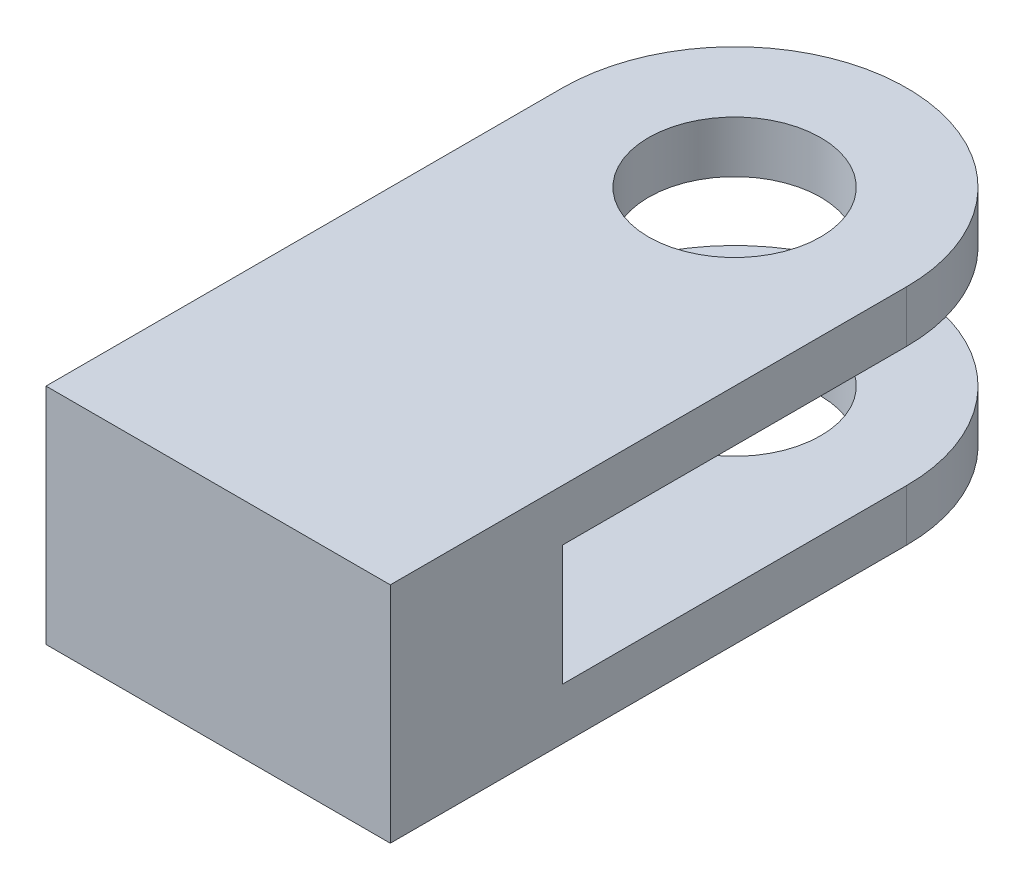
from build123d import *

# Parameters (mm, degrees)
BOSS_EXTRU_1_DEPTH           = 6.5
ENL_V_MAT_EXTRU_1_DEPTH      = 20
ENL_V_MAT_EXTRU_1_DEPTH_BACK = 33.283896915
ESQUISSE4_W                  = 20
ESQUISSE4_H                  = 7
ESQUISSE5_R                  = 5
ENL_V_MAT_EXTRU_2_DEPTH      = 35.190641995


with BuildPart() as part:
    # Esquisse3 → Boss.-Extru.1 (new, symmetric)
    with BuildSketch(Plane(origin=(0, 0, 0), x_dir=(1, 0, 0), z_dir=(0, 1, 0))):
        with BuildLine():
            Line((-10, -30), (-10, 0))
            ThreePointArc((-10, 0), (0, 10), (10, 0))
            Line((10, 0), (10, -30))
            Line((10, -30), (-10, -30))
        make_face()
    extrude(amount=BOSS_EXTRU_1_DEPTH, both=True)

    # Esquisse4 → Enlèv. mat.-Extru.1 (cut, two sides: drawn at the far end of the back side and taken through both)
    with BuildSketch(Plane.XY.offset(-ENL_V_MAT_EXTRU_1_DEPTH_BACK)):
        Rectangle(ESQUISSE4_W, ESQUISSE4_H)
    extrude(amount=ENL_V_MAT_EXTRU_1_DEPTH + ENL_V_MAT_EXTRU_1_DEPTH_BACK, mode=Mode.SUBTRACT)

    # Esquisse5 → Enlèv. mat.-Extru.2 (cut, through all)
    with BuildSketch(Plane(origin=(0, 6.5, 0), x_dir=(1, 0, 0), z_dir=(0, 1, 0))):
        with Locations(Location((0, 0, 0), (0, 0, 270))):
            Circle(ESQUISSE5_R)
    extrude(amount=-ENL_V_MAT_EXTRU_2_DEPTH, mode=Mode.SUBTRACT)


solid = part.part
